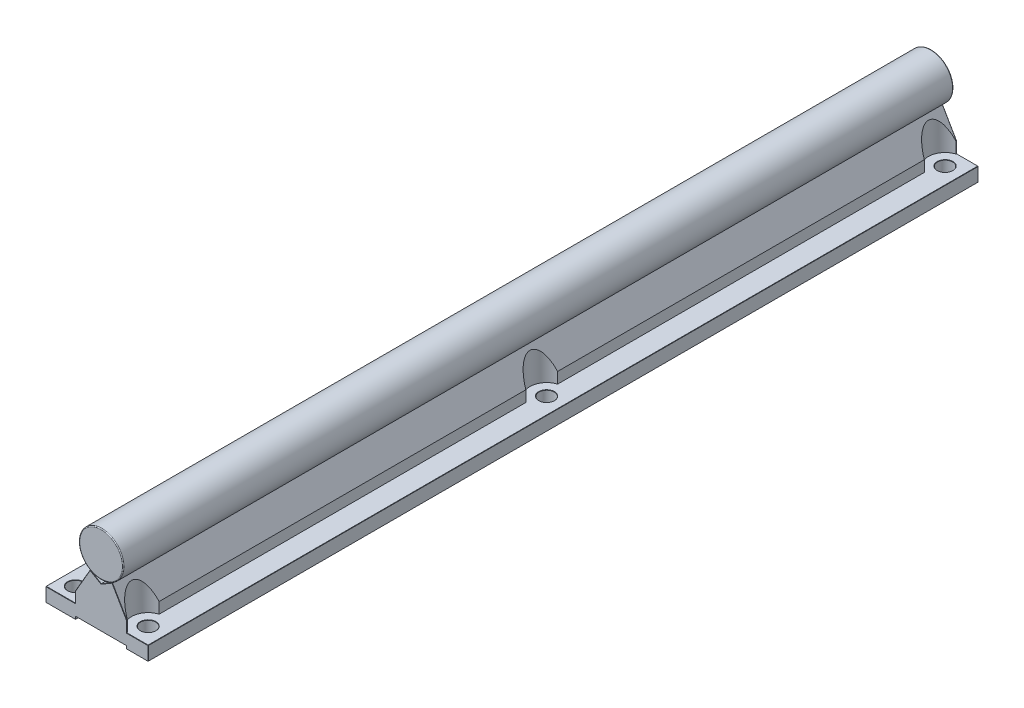
from build123d import *

# Parameters (mm, degrees)
SKETCH1_R           = 8
BOSS_EXTRUDE1_DEPTH = 300
BOSS_EXTRUDE3_DEPTH = 300
FILLET1_R           = 0.3
SKETCH2_R           = 6
CUT_EXTRUDE1_DEPTH  = 12
SKETCH5_R           = 2.75
CUT_EXTRUDE2_DEPTH  = 5
SKETCH9_R           = 2.75
CUT_EXTRUDE3_DEPTH  = 5
LPATTERN1_COUNT     = 2
LPATTERN1_PITCH     = 144
LPATTERN2_COUNT     = 2
LPATTERN2_PITCH     = 144
CHAMFER1_SIZE       = 0.1


with BuildPart() as part:
    # Sketch1 → Boss-Extrude1 (new body)
    with BuildSketch(Plane.XY):
        with Locations((22.854793834, 30.224227114)):
            Circle(SKETCH1_R)
    extrude(amount=-BOSS_EXTRUDE1_DEPTH)

    # Fillet1
    fillet1_edges = [part.edges().sort_by_distance(p)[0] for p in [
        (14.854793834, 30.224227114, -300),
        (14.854793834, 30.224227114, 0),
    ]]
    fillet(fillet1_edges, radius=FILLET1_R)


with BuildPart() as body_2:
    # Sketch1<5> → Boss-Extrude3 (new body)
    with BuildSketch(Plane.XY):
        Polygon((2.854793834, 5.224227114), (2.854793834, 10.224227114), (13.604793834, 10.224227114), (13.604793834, 14.202757144), (18.854793834, 23.296023883), (22.854793834, 20.986622807), (26.854793834, 23.296023883), (32.104793834, 14.202757144), (32.104793834, 10.224227114), (39.854793834, 10.224227114), (39.854793834, 5.224227114), (32.104793834, 5.224227114), (32.104793834, 6.224227114), (13.604793834, 6.224227114), (13.604793834, 5.224227114), align=None)
    extrude(amount=-BOSS_EXTRUDE3_DEPTH)

    # Sketch2 → Cut-Extrude1 (cut)
    with BuildSketch(Plane(origin=(0, 10.224227114, 0), x_dir=(1, 0, 0), z_dir=(0, 1, 0))):
        with Locations((33.854793834, 294)):
            Circle(SKETCH2_R)
    cut_extrude1 = extrude(amount=CUT_EXTRUDE1_DEPTH, mode=Mode.SUBTRACT)

    # Sketch5 → Cut-Extrude2 (cut)
    with BuildSketch(Plane(origin=(0, 10.224227114, 0), x_dir=(1, 0, 0), z_dir=(0, 1, 0))):
        with Locations((33.854793834, 294)):
            Circle(SKETCH5_R)
    cut_extrude2 = extrude(amount=-CUT_EXTRUDE2_DEPTH, mode=Mode.SUBTRACT)

    # Mirror3: Cut-Extrude1, Cut-Extrude2 across plane
    add(cut_extrude1.mirror(Plane.XY.offset(-150)), mode=Mode.SUBTRACT)
    add(cut_extrude2.mirror(Plane.XY.offset(-150)), mode=Mode.SUBTRACT)

    # Sketch9 → Cut-Extrude3 (cut)
    with BuildSketch(Plane(origin=(0, 10.224227114, 0), x_dir=(1, 0, 0), z_dir=(0, 1, 0))):
        with Locations((8.229793834, 294.62)):
            Circle(SKETCH9_R)
    cut_extrude3 = extrude(amount=-CUT_EXTRUDE3_DEPTH, mode=Mode.SUBTRACT)

    # Mirror5: Cut-Extrude3 across plane
    add(cut_extrude3.mirror(Plane.XY.offset(-150)), mode=Mode.SUBTRACT)

    # LPattern1: Cut-Extrude1, Cut-Extrude2 ×2
    with Locations(*[(0, 0, i * LPATTERN1_PITCH) for i in range(1, LPATTERN1_COUNT)]):
        add(cut_extrude1, mode=Mode.SUBTRACT)
        add(cut_extrude2, mode=Mode.SUBTRACT)

    # LPattern2: Cut-Extrude3 ×2
    with Locations(*[(0, 0, i * LPATTERN2_PITCH) for i in range(1, LPATTERN2_COUNT)]):
        add(cut_extrude3, mode=Mode.SUBTRACT)

    # Chamfer1
    chamfer1_edges = [body_2.edges().sort_by_distance(p)[0] for p in [
        (2.854793834, 7.724227114, -300),
        (39.854793834, 7.724227114, -300),
        (35.979793834, 10.224227114, -300),
        (32.104793834, 12.213492129, -300),
        (29.479793834, 18.749390513, -300),
        (24.854793834, 22.141323345, -300),
        (20.854793834, 22.141323345, -300),
        (16.229793834, 18.749390513, -300),
        (13.604793834, 12.213492129, -300),
        (8.229793834, 10.224227114, -300),
        (2.854793834, 7.724227114, 0),
        (39.854793834, 7.724227114, 0),
        (39.854793834, 10.224227114, -150),
        (35.979793834, 10.224227114, 0),
        (32.104793834, 12.213492129, 0),
        (29.479793834, 18.749390513, 0),
        (24.854793834, 22.141323345, 0),
        (20.854793834, 22.141323345, 0),
        (16.229793834, 18.749390513, 0),
        (13.604793834, 12.213492129, 0),
        (8.229793834, 10.224227114, 0),
        (2.854793834, 10.224227114, -150),
        (31.104793834, 10.224227114, -6),
        (5.479793834, 10.224227114, -5.38),
        (31.104793834, 10.224227114, -150),
        (5.479793834, 10.224227114, -150.62),
        (31.104793834, 10.224227114, -294),
        (5.479793834, 10.224227114, -294.62),
    ]]
    chamfer(chamfer1_edges, length=CHAMFER1_SIZE)


solid = Compound([part.part, body_2.part])
